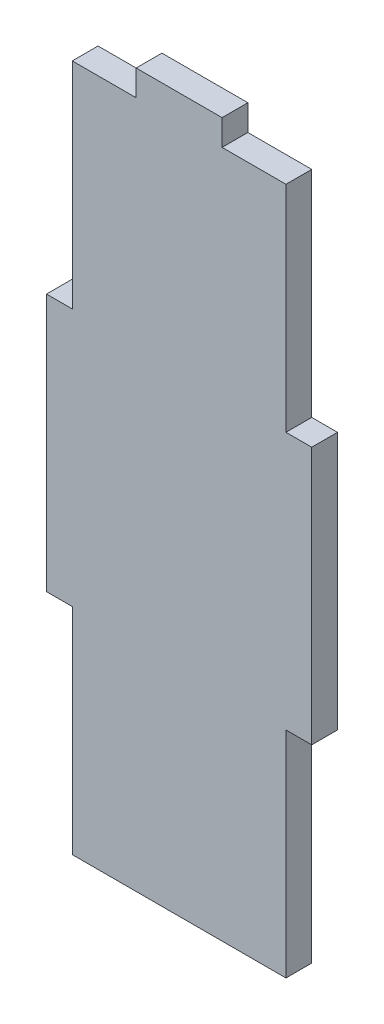
from build123d import *

# Parameters (mm, degrees)
EXTRUDE_1_DEPTH = 3


with BuildPart() as part:
    # 草图1 → 凸台-拉伸1 (new body)
    with BuildSketch(Plane.XY):
        Polygon((0, -25), (0, -40), (12.435, -40), (12.435, 0), (7.435, 0), (0, 0), align=None)
        Polygon((12.435, 0), (12.435, -40), (24.87, -40), (24.87, -25), (24.87, 0), (17.435, 0), align=None)
        Polygon((24.87, -40), (12.435, -40), (12.435, -80), (24.87, -80), (24.87, -55), align=None)
        Polygon((12.435, -40), (0, -40), (0, -55), (0, -80), (12.435, -80), align=None)
        Polygon((0, -55), (0, -40), (0, -25), (-3, -25), (-3, -55), align=None)
        Polygon((7.435, 0), (12.435, 0), (17.435, 0), (17.435, 3), (7.435, 3), align=None)
        Polygon((24.87, -25), (24.87, -40), (24.87, -55), (27.87, -55), (27.87, -25), align=None)
    extrude(amount=EXTRUDE_1_DEPTH)


solid = part.part
